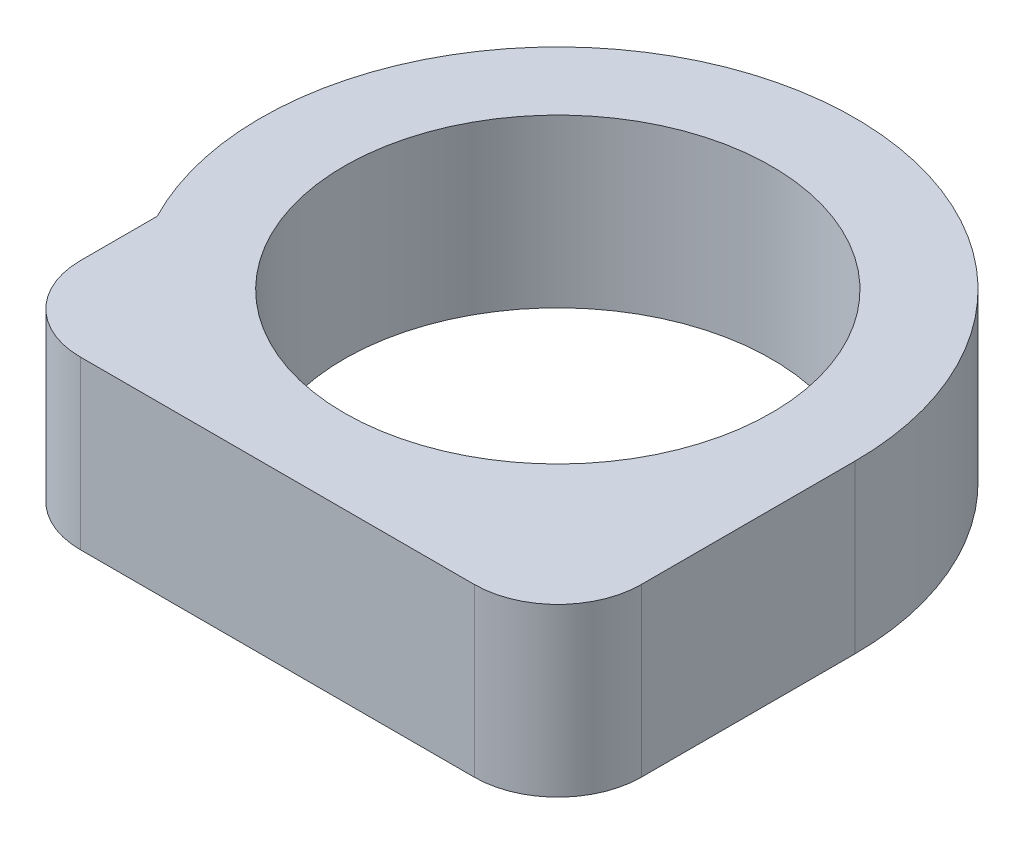
from build123d import *

# Parameters (mm, degrees)
SKETCH1_R           = 12.8
BOSS_EXTRUDE2_DEPTH = 10
FILLET1_R           = 5


with BuildPart() as part:
    # Sketch1 → Boss-Extrude2 (new body)
    with BuildSketch(Plane(origin=(0, 0, 0), x_dir=(1, 0, 0), z_dir=(0, 1, 0))):
        with BuildLine():
            Line((15.087461292, -16.184019493), (15.087461292, 1.615980507))
            ThreePointArc((15.087461292, 1.615980507), (-6.93154333, 18.908753564), (-18.512538708, -6.581580106))
            Line((-18.512538708, -6.581580106), (-18.512538708, -16.184019493))
            Line((-18.512538708, -16.184019493), (15.087461292, -16.184019493))
        make_face()
        with Locations(Location((-2.712538708, 1.615980507, 0), (0, 0, 270))):
            Circle(SKETCH1_R, mode=Mode.SUBTRACT)
    extrude(amount=BOSS_EXTRUDE2_DEPTH)

    # Fillet1
    fillet1_edges = [part.edges().sort_by_distance(p)[0] for p in [
        (15.087461292, 5, 16.184019493),
        (-18.512538708, 5, 16.184019493),
    ]]
    fillet(fillet1_edges, radius=FILLET1_R)


solid = part.part
